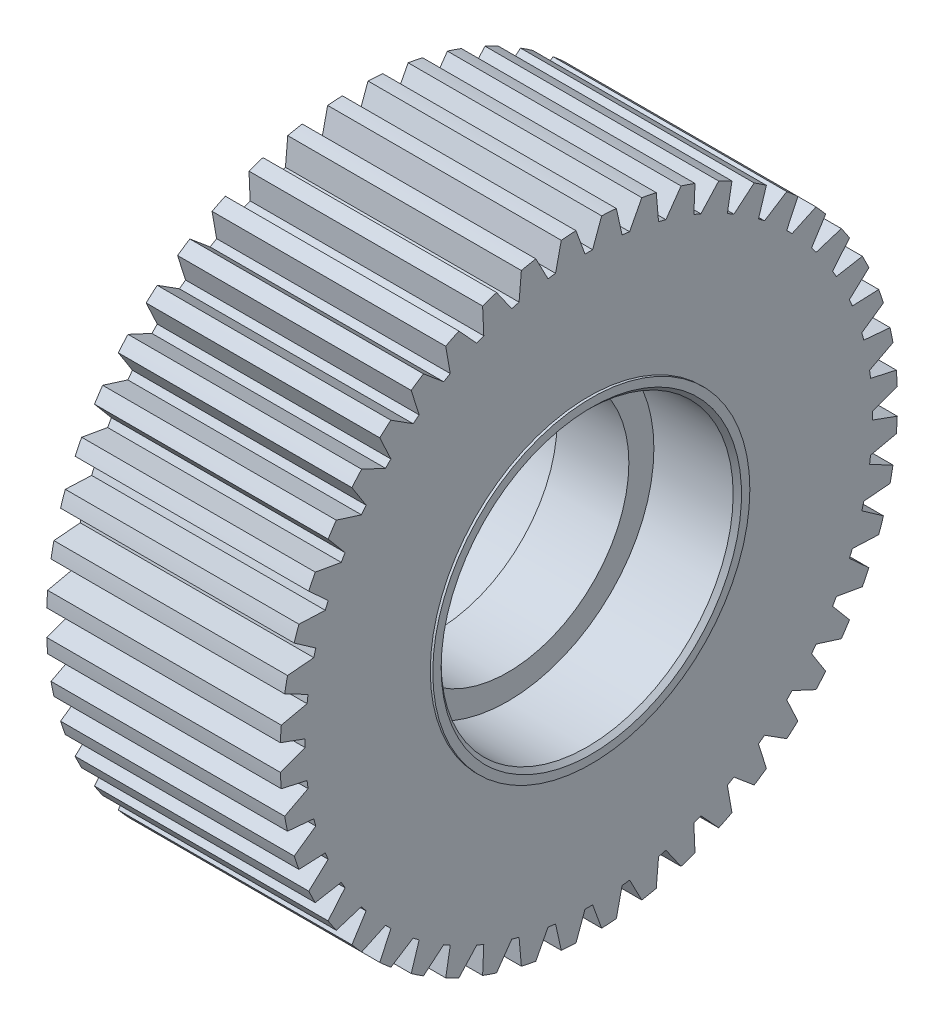
from build123d import *

# Parameters (mm, degrees)
SCHNITT_LINEAR_AUSTRAGEN1_REACH = 61.489
KREISMUSTER1_COUNT              = 48


with BuildPart() as part:
    # Skizze1 → Rotation1 (revolve)
    with BuildSketch(Plane.XY):
        Polygon((-14.3, 19), (-14.3, 18), (-13.8, 17.5), (-4.3, 17.5), (-4.3, 14.5), (4.3, 14.5), (4.3, 17.5), (13.8, 17.5), (14.3, 18), (14.3, 19), (14, 19), (14, 37), (-14, 37), (-14, 19), align=None)
    revolve(axis=Axis((-36.010442658, 0, 0), (1, 0, 0)))

    # Skizze2 → Schnitt-Linear austragen1 (cut, up to next)
    with BuildSketch(Plane(origin=(14, 0, 0), x_dir=(0, 0, -1), z_dir=(1, 0, 0)), mode=Mode.PRIVATE) as schnitt_linear_austragen1_sk1:
        with BuildLine():
            Line((0.4559635, 33.99694247), (1.537357277, 36.968047455))
            ThreePointArc((1.537357277, 36.968047455), (0, 37), (-1.537357277, 36.968047455))
            Line((-1.537357277, 36.968047455), (-0.4559635, 33.99694247))
            ThreePointArc((-0.4559635, 33.99694247), (0, 34), (0.4559635, 33.99694247))
        make_face()
    schnitt_linear_austragen1_tool1 = extrude(schnitt_linear_austragen1_sk1.sketch, amount=-SCHNITT_LINEAR_AUSTRAGEN1_REACH, mode=Mode.PRIVATE) & part.part
    schnitt_linear_austragen1 = schnitt_linear_austragen1_tool1.solids().sort_by_distance((14, 35.765137, 0))[0]
    add(schnitt_linear_austragen1, mode=Mode.SUBTRACT)

    # Kreismuster1: Schnitt-Linear austragen1 ×48 about axis
    kreismuster1_axis = Axis((-15.73, 0, 0), (1, 0, 0))
    for i in range(1, KREISMUSTER1_COUNT):
        add(schnitt_linear_austragen1.rotate(kreismuster1_axis, i * 360 / KREISMUSTER1_COUNT), mode=Mode.SUBTRACT)


solid = part.part
